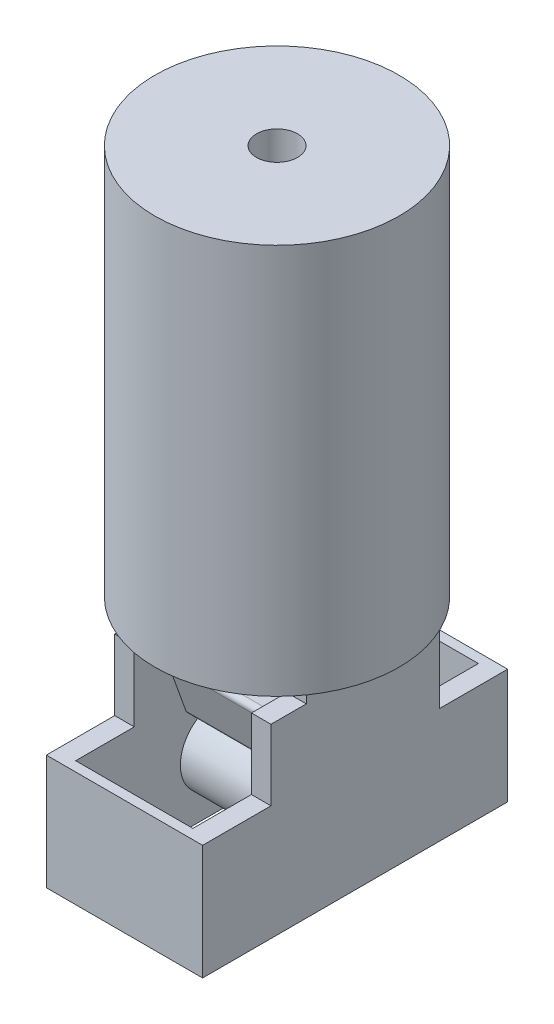
from build123d import *

# Parameters (mm, degrees)
SKETCH2_R            = 3.9
BOSS_EXTRUDE1_DEPTH  = 12
SKETCH3_R            = 6
BOSS_EXTRUDE2_DEPTH  = 2
BOSS_EXTRUDE3_START  = 2
SKETCH4_R            = 6
BOSS_EXTRUDE3_DEPTH  = 2
SKETCH5_W            = 19.497175456
SKETCH5_H            = 13.883202756
CUT_EXTRUDE1_DEPTH   = 5
SKETCH6_W            = 2
SKETCH6_H            = 6.63324958
BOSS_EXTRUDE4_DEPTH  = 8
SKETCH7_W            = 16
SKETCH7_H            = 10
BOSS_EXTRUDE5_DEPTH  = 3
SKETCH8_R            = 12.5
BOSS_EXTRUDE6_DEPTH  = 40
SKETCH10_R           = 2.1
CUT_EXTRUDE2_DEPTH   = 21
BOSS_EXTRUDE7_DEPTH  = 12
FILLET1_R            = 0.5
SKETCH11_W           = 2
SKETCH11_H           = 19
BOSS_EXTRUDE8_DEPTH  = 11.3
SKETCH13_W           = 2
SKETCH13_H           = 19
BOSS_EXTRUDE9_DEPTH  = 11.3
SKETCH14_W           = 16
SKETCH14_H           = 19
BOSS_EXTRUDE10_DEPTH = 1
SKETCH15_W           = 16
SKETCH15_H           = 19
BOSS_EXTRUDE11_DEPTH = 1
SKETCH16_W           = 16
SKETCH16_H           = 7.233308129
CUT_EXTRUDE3_DEPTH   = 7
SKETCH17_W           = 16
SKETCH17_H           = 7.233308129
CUT_EXTRUDE4_DEPTH   = 7
SKETCH18_W           = 2
SKETCH18_H           = 1
BOSS_EXTRUDE12_DEPTH = 6.633249581
SKETCH19_W           = 2
SKETCH19_H           = 1
BOSS_EXTRUDE13_DEPTH = 6.633249581


with BuildPart() as part:
    # Sketch2 → Boss-Extrude1 (new body)
    with BuildSketch(Plane(origin=(0, 0, 0), x_dir=(0, 0, -1), z_dir=(1, 0, 0))):
        Circle(SKETCH2_R)
    extrude(amount=BOSS_EXTRUDE1_DEPTH)

    # Sketch3 → Boss-Extrude2 (add)
    with BuildSketch(Plane(origin=(12, 0, 0), x_dir=(0, 0, -1), z_dir=(1, 0, 0))):
        Circle(SKETCH3_R)
    extrude(amount=BOSS_EXTRUDE2_DEPTH)

    # Sketch4 → Boss-Extrude3 (add)
    with BuildSketch(Plane.ZY.offset(BOSS_EXTRUDE3_START)):
        with Locations(Location((0, 0, 0), (0, 0, 180))):
            Circle(SKETCH4_R)
    extrude(amount=-BOSS_EXTRUDE3_DEPTH)

    # Sketch5 → Cut-Extrude1 (cut)
    with BuildSketch(Plane(origin=(0, 5, 0), x_dir=(1, 0, 0), z_dir=(0, 1, 0))):
        with Locations((6.056898372, 0.369839418)):
            Rectangle(SKETCH5_W, SKETCH5_H)
    extrude(amount=CUT_EXTRUDE1_DEPTH, mode=Mode.SUBTRACT)

    # Sketch6 → Boss-Extrude4 (add)
    with BuildSketch(Plane(origin=(0, 5, 0), x_dir=(1, 0, 0), z_dir=(0, 1, 0))):
        with Locations((13, 0)):
            Rectangle(SKETCH6_W, SKETCH6_H)
        with Locations((-1, 0)):
            Rectangle(SKETCH6_W, SKETCH6_H)
    extrude(amount=BOSS_EXTRUDE4_DEPTH)

    # Sketch7 → Boss-Extrude5 (add)
    with BuildSketch(Plane(origin=(0, 13, 0), x_dir=(1, 0, 0), z_dir=(0, 1, 0))):
        with Locations((6, 0)):
            Rectangle(SKETCH7_W, SKETCH7_H)
    extrude(amount=BOSS_EXTRUDE5_DEPTH)

    # Sketch8 → Boss-Extrude6 (add)
    with BuildSketch(Plane(origin=(0, 16, 0), x_dir=(1, 0, 0), z_dir=(0, 1, 0))):
        with Locations(Location((6, 0, 0), (0, 0, 270))):
            Circle(SKETCH8_R)
    extrude(amount=BOSS_EXTRUDE6_DEPTH)

    # Sketch10 → Cut-Extrude2 (cut)
    with BuildSketch(Plane(origin=(0, 56, 0), x_dir=(1, 0, 0), z_dir=(0, 1, 0))):
        with Locations(Location((6, 0, 0), (0, 0, 270))):
            Circle(SKETCH10_R)
    extrude(amount=-CUT_EXTRUDE2_DEPTH, mode=Mode.SUBTRACT)

    # Sketch12 → Boss-Extrude7 (add)
    with BuildSketch(Plane.ZY.offset(-12)):
        Polygon((-3.2, 4.2), (3.2, 4.2), (5, 9.2), (5.36, 10.2), (-5.36, 10.2), (-5, 9.2), align=None)
    extrude(amount=BOSS_EXTRUDE7_DEPTH)

    # Fillet1
    fillet1_edges = [part.edges().sort_by_distance(p)[0] for p in [
        (6, 4.2, -3.2),
        (6, 4.2, 3.2),
        (6, 10.2, 5.36),
        (6, 10.2, -5.36),
    ]]
    fillet(fillet1_edges, radius=FILLET1_R)

    # Sketch11 → Boss-Extrude8 (add)
    with BuildSketch(Plane.XY.offset(3.31662479)):
        with Locations((13, 3.5)):
            Rectangle(SKETCH11_W, SKETCH11_H)
        with Locations((-1, 3.5)):
            Rectangle(SKETCH11_W, SKETCH11_H)
    extrude(amount=BOSS_EXTRUDE8_DEPTH)

    # Sketch13 → Boss-Extrude9 (add)
    with BuildSketch(Plane(origin=(0, 0, -3.31662479), x_dir=(-1, 0, 0), z_dir=(0, 0, -1))):
        with Locations((-13, 3.5)):
            Rectangle(SKETCH13_W, SKETCH13_H)
        with Locations((1, 3.5)):
            Rectangle(SKETCH13_W, SKETCH13_H)
    extrude(amount=BOSS_EXTRUDE9_DEPTH)

    # Sketch14 → Boss-Extrude10 (add)
    with BuildSketch(Plane.XY.offset(14.61662479)):
        with Locations((6, 3.5)):
            Rectangle(SKETCH14_W, SKETCH14_H)
    extrude(amount=BOSS_EXTRUDE10_DEPTH)

    # Sketch15 → Boss-Extrude11 (add)
    with BuildSketch(Plane(origin=(0, 0, -14.61662479), x_dir=(-1, 0, 0), z_dir=(0, 0, -1))):
        with Locations((-6, 3.5)):
            Rectangle(SKETCH15_W, SKETCH15_H)
    extrude(amount=BOSS_EXTRUDE11_DEPTH)

    # Sketch16 → Cut-Extrude3 (cut)
    with BuildSketch(Plane(origin=(0, 0, -15.61662479), x_dir=(-1, 0, 0), z_dir=(0, 0, -1))):
        with Locations((-6, 9.383345935)):
            Rectangle(SKETCH16_W, SKETCH16_H)
    extrude(amount=-CUT_EXTRUDE3_DEPTH, mode=Mode.SUBTRACT)

    # Sketch17 → Cut-Extrude4 (cut)
    with BuildSketch(Plane.XY.offset(15.61662479)):
        with Locations((6, 9.383345935)):
            Rectangle(SKETCH17_W, SKETCH17_H)
    extrude(amount=-CUT_EXTRUDE4_DEPTH, mode=Mode.SUBTRACT)

    # Sketch18 → Boss-Extrude12 (add)
    with BuildSketch(Plane(origin=(0, 0, 3.31662479), x_dir=(-1, 0, 0), z_dir=(0, 0, -1))):
        with Locations((-13, -5.5)):
            Rectangle(SKETCH18_W, SKETCH18_H)
    extrude(amount=BOSS_EXTRUDE12_DEPTH)

    # Sketch19 → Boss-Extrude13 (add)
    with BuildSketch(Plane(origin=(0, 0, 3.31662479), x_dir=(-1, 0, 0), z_dir=(0, 0, -1))):
        with Locations((1, -5.5)):
            Rectangle(SKETCH19_W, SKETCH19_H)
    extrude(amount=BOSS_EXTRUDE13_DEPTH)


solid = part.part
